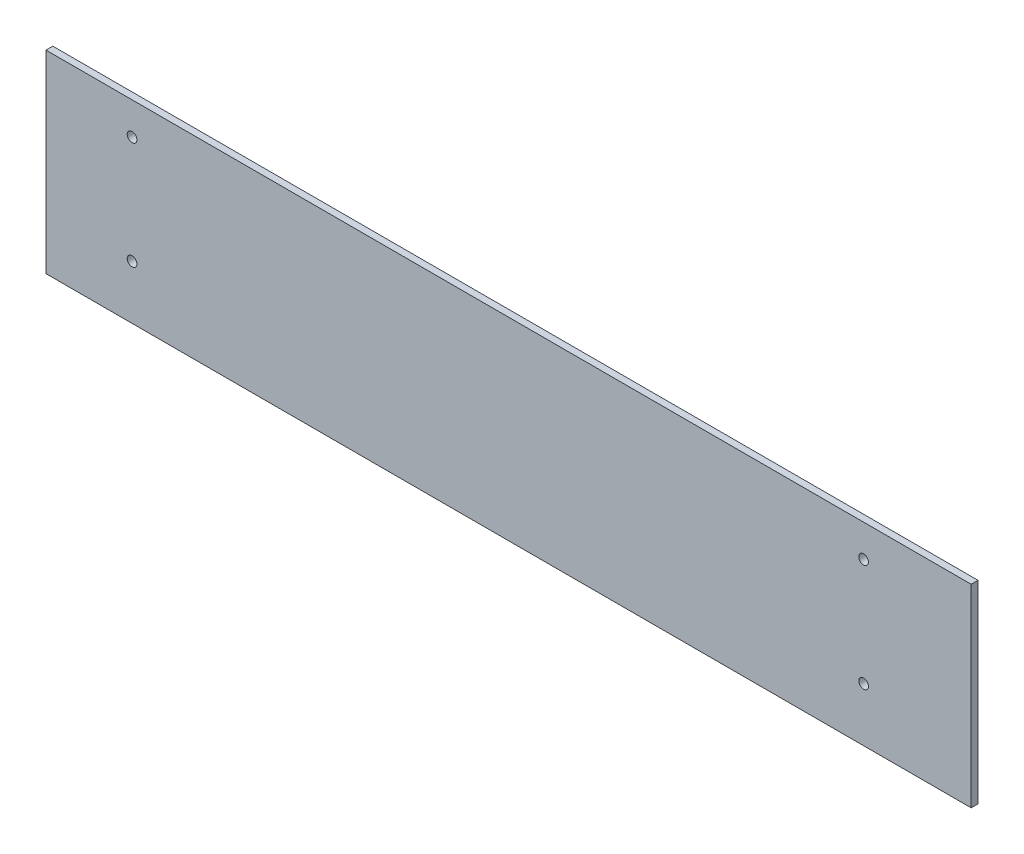
from build123d import *

# Parameters (mm, degrees)
SKETCH1_W                = 430
SKETCH1_H                = 90
BOSS_EXTRUDE1_DEPTH      = 3.175
M4_CLEARANCE_HOLE1_D     = 4.5
M4_CLEARANCE_HOLE1_DEPTH = 10.1
M4_CLEARANCE_HOLE1_TIP   = 1.351936393


with BuildPart() as part:
    # Sketch1 → Boss-Extrude1 (new body)
    with BuildSketch(Plane.XY):
        Rectangle(SKETCH1_W, SKETCH1_H)
    extrude(amount=BOSS_EXTRUDE1_DEPTH)

    # M4 Clearance Hole1
    with Locations(Plane.XY.offset(3.175)):
        with Locations((165, 30), (-175, -20), (-175, 30), (165, -20)):
            Hole(M4_CLEARANCE_HOLE1_D / 2, depth=M4_CLEARANCE_HOLE1_DEPTH)
            with Locations((0, 0, -(M4_CLEARANCE_HOLE1_DEPTH + M4_CLEARANCE_HOLE1_TIP / 2))):  # 118° drill point
                Cone(0, M4_CLEARANCE_HOLE1_D / 2, M4_CLEARANCE_HOLE1_TIP, mode=Mode.SUBTRACT)


solid = part.part
